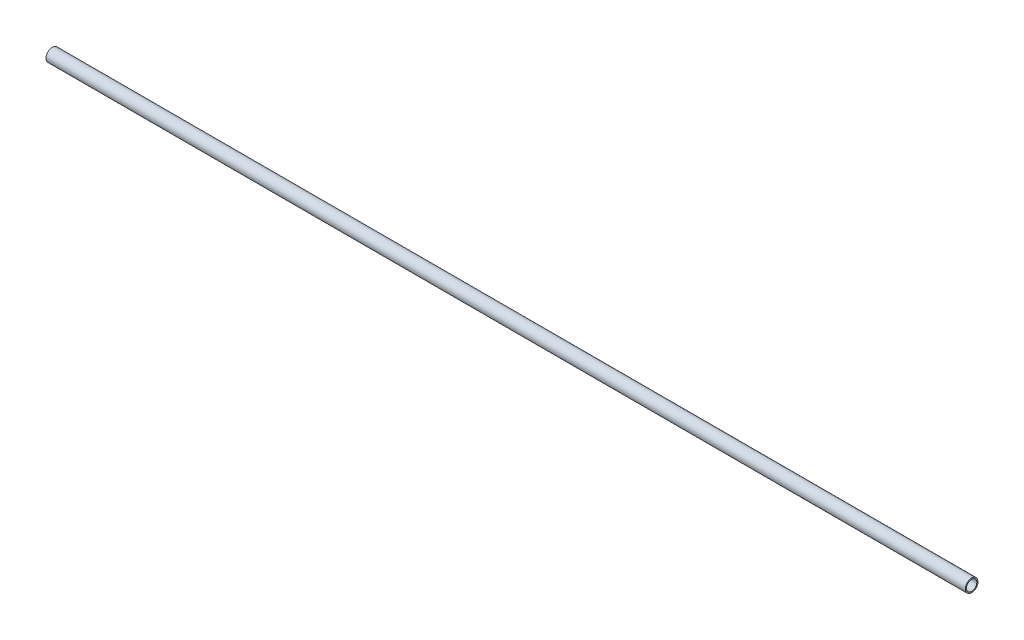
from build123d import *

# Parameters (mm, degrees)
SKETCH1_R           = 12.7
SKETCH1_R_2         = 10.287
BOSS_EXTRUDE1_DEPTH = 1828.8


with BuildPart() as part:
    # Sketch1 → Boss-Extrude1 (new body)
    with BuildSketch(Plane(origin=(0, 0, 0), x_dir=(0, 0, -1), z_dir=(1, 0, 0))):
        with Locations(Location((0, 0, 0), (0, 0, 180))):
            Circle(SKETCH1_R)
        with Locations(Location((0, 0, 0), (0, 0, 180))):
            Circle(SKETCH1_R_2, mode=Mode.SUBTRACT)
    extrude(amount=BOSS_EXTRUDE1_DEPTH)


solid = part.part
